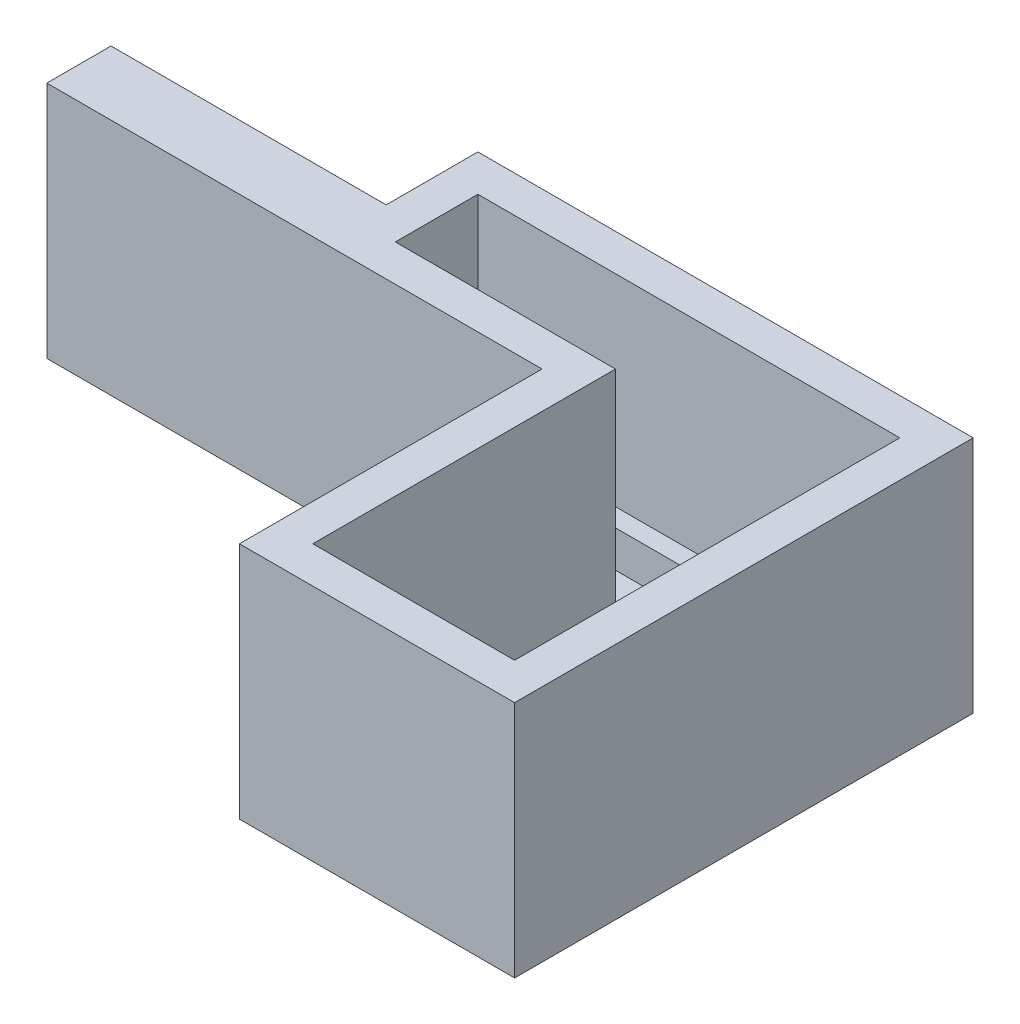
from build123d import *

# Parameters (mm, degrees)
EXTRUDE_1_DEPTH     = 13
CUT_EXTRUDE_1_DEPTH = 11
SKETCH_5_W          = 14
SKETCH_5_H          = 2
CUT_EXTRUDE_2_DEPTH = 10
SKETCH_8_R          = 1.65
CUT_EXTRUDE_5_DEPTH = 20


with BuildPart() as part:
    # 草图1 → 凸台-拉伸1 (new body)
    with BuildSketch(Plane(origin=(0, 0, 0), x_dir=(1, 0, 0), z_dir=(0, 1, 0))):
        Polygon((0, 0), (0, 14), (-27, 14), (-27, 9), (-42, 9), (-42, 5.5), (-15, 5.5), (-15, -11), (0, -11), align=None)
    extrude(amount=EXTRUDE_1_DEPTH)

    # 草图3 → 切除-拉伸1 (cut)
    with BuildSketch(Plane(origin=(0, 13, 0), x_dir=(1, 0, 0), z_dir=(0, 1, 0))):
        Polygon((-13, -9), (-2, -9), (-2, 12), (-25, 12), (-25, 7.5), (-13, 7.5), align=None)
    extrude(amount=-CUT_EXTRUDE_1_DEPTH, mode=Mode.SUBTRACT)

    # 草图5 → 切除-拉伸2 (cut)
    with BuildSketch(Plane(origin=(0, 2, 0), x_dir=(1, 0, 0), z_dir=(0, 1, 0))):
        with Locations((-16, 10)):
            Rectangle(SKETCH_5_W, SKETCH_5_H)
    extrude(amount=-CUT_EXTRUDE_2_DEPTH, mode=Mode.SUBTRACT)

    # 草图8 → 切除-拉伸5 (cut)
    with BuildSketch(Plane(origin=(0, 2, 0), x_dir=(1, 0, 0), z_dir=(0, 1, 0))):
        with Locations(Location((-7.5, 8, 0), (0, 0, 270))):
            Circle(SKETCH_8_R)
        with Locations(Location((-7.5, -5, 0), (0, 0, 270))):
            Circle(SKETCH_8_R)
    extrude(amount=-CUT_EXTRUDE_5_DEPTH, mode=Mode.SUBTRACT)


solid = part.part
